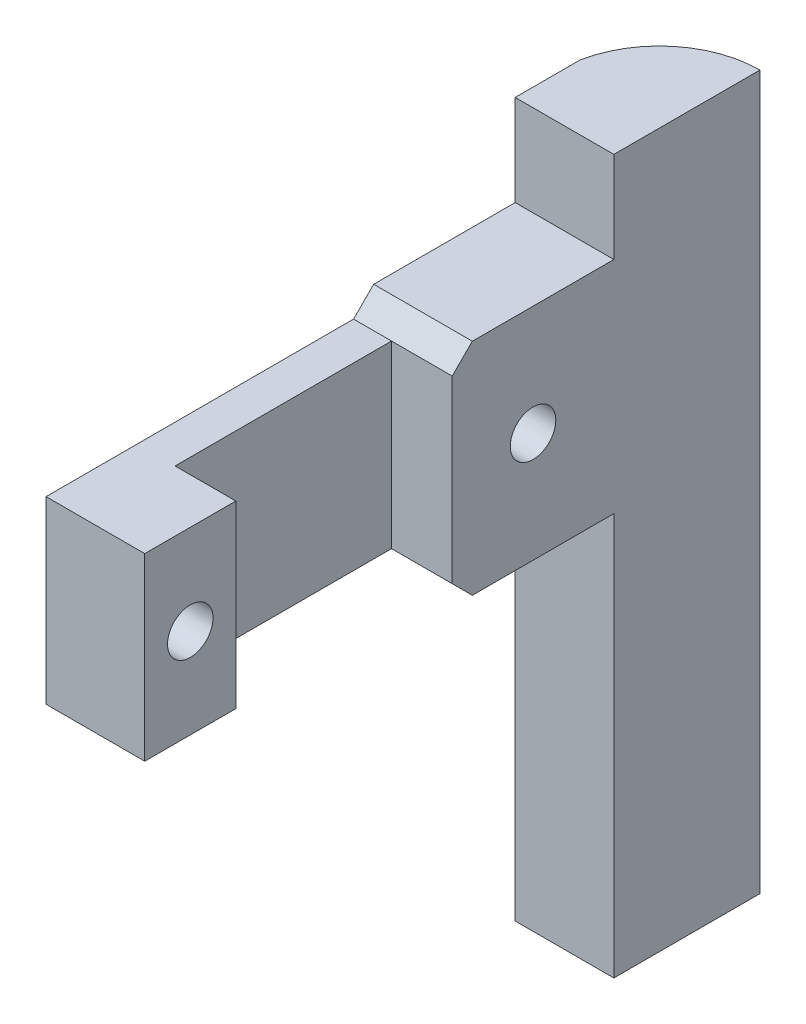
from build123d import *

# Parameters (mm, degrees)
SKETCH1_W                       = 21.3
SKETCH1_H                       = 29
BOSS_EXTRUDE1_DEPTH             = 25.87
CUT_EXTRUDE1_DEPTH              = 32.510782282
SKETCH5_W                       = 5
SKETCH5_H                       = 23.7
BOSS_EXTRUDE2_DEPTH             = 31.52
SKETCH6_W                       = 5
SKETCH6_H                       = 23.7
BOSS_EXTRUDE3_DEPTH             = 15.9
SKETCH7_W                       = 25.87
SKETCH7_H                       = 94
BOSS_EXTRUDE4_DEPTH             = 20
CUT_EXTRUDE2_DEPTH              = 107.224130027
SKETCH10_W                      = 25.87
SKETCH10_H                      = 23.7
BOSS_EXTRUDE5_DEPTH             = 9
SKETCH13_W                      = 25.74
SKETCH13_H                      = 140
CUT_EXTRUDE3_DEPTH              = 109.61791657
SKETCH14_W                      = 7
SKETCH14_H                      = 23.7
BOSS_EXTRUDE6_DEPTH             = 8
F_6_0MM_CLEARANCE_DOWEL_HOLE1_D = 6


with BuildPart() as part:
    # Sketch1 → Boss-Extrude1 (new body)
    with BuildSketch(Plane(origin=(0, 0, 0), x_dir=(0, 0, -1), z_dir=(1, 0, 0))):
        Rectangle(SKETCH1_W, SKETCH1_H)
    boss_extrude1 = extrude(amount=BOSS_EXTRUDE1_DEPTH)

    # Sketch3 → Cut-Extrude1 (cut, through all)
    with BuildSketch(Plane(origin=(25.87, 0, 0), x_dir=(0, 0, -1), z_dir=(1, 0, 0))):
        Polygon((-7.998349571, -14.5), (-10.65, -11.848349571), (-10.65, -14.5), align=None)
        Polygon((-10.65, 11.848349571), (-10.65, 14.5), (-7.998349571, 14.5), align=None)
    cut_extrude1 = extrude(amount=-CUT_EXTRUDE1_DEPTH, mode=Mode.SUBTRACT)

    # Sketch5 → Boss-Extrude2 (add)
    with BuildSketch(Plane.XY.offset(10.65)):
        with Locations((23.37, -0.001650429)):
            Rectangle(SKETCH5_W, SKETCH5_H)
        with Locations((2.5, -0.001650429)):
            Rectangle(SKETCH5_W, SKETCH5_H)
    boss_extrude2 = extrude(amount=BOSS_EXTRUDE2_DEPTH)

    # Sketch6 → Boss-Extrude3 (add)
    with BuildSketch(Plane.ZY.offset(-20.87)):
        with Locations((39.67, -0.001650429)):
            Rectangle(SKETCH6_W, SKETCH6_H)
    extrude(amount=BOSS_EXTRUDE3_DEPTH)

    # Sketch7 → Boss-Extrude4 (add)
    with BuildSketch(Plane(origin=(0, 0, -10.65), x_dir=(-1, 0, 0), z_dir=(0, 0, -1))):
        with Locations((-12.935, -20.5)):
            Rectangle(SKETCH7_W, SKETCH7_H)
    boss_extrude4 = extrude(amount=BOSS_EXTRUDE4_DEPTH)

    # Sketch9 → Cut-Extrude2 (cut, through all)
    with BuildSketch(Plane(origin=(0, -67.5, 0), x_dir=(-1, 0, 0), z_dir=(0, -1, 0))):
        with BuildLine():
            ThreePointArc((-26.12, 16.65), (-12.87, 29.9), (0.38, 16.65))
            Line((0.38, 16.65), (0.38, 30.65))
            Line((0.38, 30.65), (-26.12, 30.65))
            Line((-26.12, 30.65), (-26.12, 16.65))
        make_face()
    cut_extrude2 = extrude(amount=-CUT_EXTRUDE2_DEPTH, mode=Mode.SUBTRACT)

    # Sketch10 → Boss-Extrude5 (add)
    with BuildSketch(Plane.XY.offset(42.17)):
        with Locations((12.935, -0.001650429)):
            Rectangle(SKETCH10_W, SKETCH10_H)
    boss_extrude5 = extrude(amount=BOSS_EXTRUDE5_DEPTH)

    # Sketch13 → Cut-Extrude3 (cut, through all)
    with BuildSketch(Plane.XY.offset(51.17)):
        with Locations((0, -0.001650429)):
            Rectangle(SKETCH13_W, SKETCH13_H)
    cut_extrude3 = extrude(amount=-CUT_EXTRUDE3_DEPTH, mode=Mode.SUBTRACT)

    # Mirror2: Boss-Extrude1, Cut-Extrude1, Boss-Extrude2, Boss-Extrude4, Cut-Extrude2, Boss-Extrude5, Cut-Extrude3 across plane
    add(boss_extrude1.mirror(Plane(origin=(12.87, 69.998349571, -29.9), x_dir=(0, 0, 1), z_dir=(1, 0, 0))))
    add(cut_extrude1.mirror(Plane(origin=(12.87, 69.998349571, -29.9), x_dir=(0, 0, 1), z_dir=(1, 0, 0))), mode=Mode.SUBTRACT)
    add(boss_extrude2.mirror(Plane(origin=(12.87, 69.998349571, -29.9), x_dir=(0, 0, 1), z_dir=(1, 0, 0))))
    add(boss_extrude4.mirror(Plane(origin=(12.87, 69.998349571, -29.9), x_dir=(0, 0, 1), z_dir=(1, 0, 0))))
    add(cut_extrude2.mirror(Plane(origin=(12.87, 69.998349571, -29.9), x_dir=(0, 0, 1), z_dir=(1, 0, 0))), mode=Mode.SUBTRACT)
    add(boss_extrude5.mirror(Plane(origin=(12.87, 69.998349571, -29.9), x_dir=(0, 0, 1), z_dir=(1, 0, 0))))
    add(cut_extrude3.mirror(Plane(origin=(12.87, 69.998349571, -29.9), x_dir=(0, 0, 1), z_dir=(1, 0, 0))), mode=Mode.SUBTRACT)

    # Sketch14 → Boss-Extrude6 (add)
    with BuildSketch(Plane(origin=(4.87, 0, 0), x_dir=(0, 0, -1), z_dir=(1, 0, 0))):
        with Locations((-42.67, -0.001650429)):
            Rectangle(SKETCH14_W, SKETCH14_H)
    extrude(amount=BOSS_EXTRUDE6_DEPTH)

    # Ø6.0mm Clearance Dowel Hole1 (through all)
    with Locations(Plane(origin=(12.87, 0, 0), x_dir=(0, 0, -1), z_dir=(1, 0, 0))):
        with Locations((-45.17, 0), (0, 0)):
            Hole(F_6_0MM_CLEARANCE_DOWEL_HOLE1_D / 2)


solid = part.part
